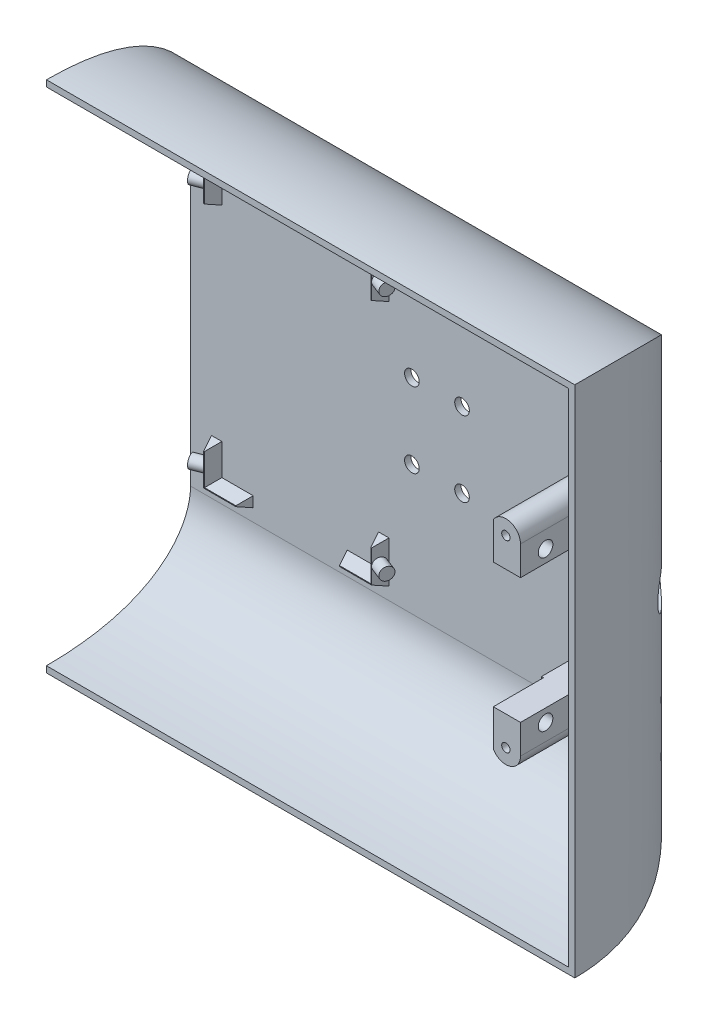
from build123d import *

# Parameters (mm, degrees)
BOSS_EXTRU_1_DEPTH           = 1.5
ENL_V_MAT_EXTRU_1_REACH      = 126.854
ESQUISSE3_R                  = 1.75
ESQUISSE4_W                  = 2.5
ESQUISSE4_H                  = 10
BOSS_EXTRU_2_DEPTH           = 3
BOSS_EXTRU_2_DRAFT           = -21
ESQUISSE4_W_2                = 10
ESQUISSE4_H_2                = 2.5
BOSS_EXTRU_2_PROFILE_2_DEPTH = 3
BOSS_EXTRU_2_PROFILE_2_DRAFT = -21
BOSS_EXTRU_2_PROFILE_3_DEPTH = 3
BOSS_EXTRU_2_PROFILE_3_DRAFT = -21
BOSS_EXTRU_2_PROFILE_4_DEPTH = 3
BOSS_EXTRU_2_PROFILE_4_DRAFT = -21
BOSS_EXTRU_2_PROFILE_5_DEPTH = 3
BOSS_EXTRU_2_PROFILE_5_DRAFT = -21
BOSS_EXTRU_2_PROFILE_6_DEPTH = 3
BOSS_EXTRU_2_PROFILE_6_DRAFT = -21
ENL_V_MAT_EXTRU_2_REACH      = 161.094
ESQUISSE8_R                  = 1
BOSS_EXTRU_3_REACH           = 161.094
ESQUISSE9_R                  = 1
ENL_V_MAT_EXTRU_3_DEPTH      = 12
ENL_V_MAT_EXTRU_4_REACH      = 149.782
ESQUISSE11_R                 = 1.75
BOSS_EXTRU_4_REACH           = 149.42
ESQUISSE16_W                 = 15
ESQUISSE16_H                 = 12
ENL_V_MAT_EXTRU_5_REACH      = 211.69
ESQUISSE12_R                 = 4.25
ESQUISSE17_W                 = 4
ESQUISSE17_H                 = 12
ENL_V_MAT_EXTRU_6_DEPTH      = 8
ESQUISSE20_R                 = 1.5
BOSS_EXTRU_5_DEPTH           = 3
ESQUISSE21_R                 = 1.5
BOSS_EXTRU_6_DEPTH           = 3


with BuildPart() as part:
    # Esquisse1 → Boss.-Extru.1 (new body)
    with BuildSketch(Plane.XY):
        Polygon((100.649081925, 73.864865318), (-4.350918075, 73.864865318), (-4.350918075, 33.864865318), (-4.350918075, -6.135134682), (100.649081925, -6.135134682), align=None)
    extrude(amount=BOSS_EXTRU_1_DEPTH)

    # Esquisse3 → Enlèv. mat.-Extru.1 (cut, up to next)
    with BuildSketch(Plane.XY.offset(1.5), mode=Mode.PRIVATE) as enl_v_mat_extru_1_sk1:
        with Locations((48.649081925, 42.864865318)):
            Circle(ESQUISSE3_R)
    enl_v_mat_extru_1_tool1 = extrude(enl_v_mat_extru_1_sk1.sketch, amount=-ENL_V_MAT_EXTRU_1_REACH, mode=Mode.PRIVATE) & part.part
    # Esquisse3 → Enlèv. mat.-Extru.1 (cut, up to next)
    with BuildSketch(Plane.XY.offset(1.5), mode=Mode.PRIVATE) as enl_v_mat_extru_1_sk2:
        with Locations((48.649081925, 24.864865318)):
            Circle(ESQUISSE3_R)
    enl_v_mat_extru_1_tool2 = extrude(enl_v_mat_extru_1_sk2.sketch, amount=-ENL_V_MAT_EXTRU_1_REACH, mode=Mode.PRIVATE) & part.part
    # Esquisse3 → Enlèv. mat.-Extru.1 (cut, up to next)
    with BuildSketch(Plane.XY.offset(1.5), mode=Mode.PRIVATE) as enl_v_mat_extru_1_sk3:
        with Locations((60.649081925, 24.864865318)):
            Circle(ESQUISSE3_R)
    enl_v_mat_extru_1_tool3 = extrude(enl_v_mat_extru_1_sk3.sketch, amount=-ENL_V_MAT_EXTRU_1_REACH, mode=Mode.PRIVATE) & part.part
    # Esquisse3 → Enlèv. mat.-Extru.1 (cut, up to next)
    with BuildSketch(Plane.XY.offset(1.5), mode=Mode.PRIVATE) as enl_v_mat_extru_1_sk4:
        with Locations((60.649081925, 42.864865318)):
            Circle(ESQUISSE3_R)
    enl_v_mat_extru_1_tool4 = extrude(enl_v_mat_extru_1_sk4.sketch, amount=-ENL_V_MAT_EXTRU_1_REACH, mode=Mode.PRIVATE) & part.part
    add(enl_v_mat_extru_1_tool1.solids().sort_by_distance((48.649082, 42.864865, 1.5))[0], mode=Mode.SUBTRACT)
    add(enl_v_mat_extru_1_tool2.solids().sort_by_distance((48.649082, 24.864865, 1.5))[0], mode=Mode.SUBTRACT)
    add(enl_v_mat_extru_1_tool3.solids().sort_by_distance((60.649082, 24.864865, 1.5))[0], mode=Mode.SUBTRACT)
    add(enl_v_mat_extru_1_tool4.solids().sort_by_distance((60.649082, 42.864865, 1.5))[0], mode=Mode.SUBTRACT)


with BuildPart() as boss_extru_2_tool:
    # Esquisse4 → Boss.-Extru.2 (with draft: the straight prism first)
    with BuildSketch(Plane(origin=(0, 0, 1.5), x_dir=(-1, 0, 0), z_dir=(0, 0, -1))):
        with Locations((-1.899081925, 60.864865318)):
            Rectangle(ESQUISSE4_W, ESQUISSE4_H)
    extrude(amount=-BOSS_EXTRU_2_DEPTH)
    # Boss.-Extru.2: the draft: its side faces are tilted about the plane it starts from
    boss_extru_2_sides = [boss_extru_2_tool.faces().sort_by_distance(p)[0] for p in [
        (3.149081925, 60.864865318, 3),
        (1.899081925, 55.864865318, 3),
        (0.649081925, 60.864865318, 3),
        (1.899081925, 65.864865318, 3),
    ]]
    draft(boss_extru_2_sides, Plane(origin=(0, 0, 1.5), x_dir=(-1, 0, 0), z_dir=(0, 0, -1)), BOSS_EXTRU_2_DRAFT)


with BuildPart() as part_1:
    add(part.part)

    # Boss.-Extru.2: add boss_extru_2_tool
    add(boss_extru_2_tool.part)


with BuildPart() as boss_extru_2_profile_2_tool:
    # Esquisse4 → Boss.-Extru.2 profile 2 (with draft: the straight prism first)
    with BuildSketch(Plane(origin=(0, 0, 1.5), x_dir=(-1, 0, 0), z_dir=(0, 0, -1))):
        with Locations((-10.649081925, 69.614865318)):
            Rectangle(ESQUISSE4_W_2, ESQUISSE4_H_2)
    extrude(amount=-BOSS_EXTRU_2_PROFILE_2_DEPTH)
    # Boss.-Extru.2 profile 2: the draft: its side faces are tilted about the plane it starts from
    boss_extru_2_profile_2_sides = [boss_extru_2_profile_2_tool.faces().sort_by_distance(p)[0] for p in [
        (10.649081925, 70.864865318, 3),
        (15.649081925, 69.614865318, 3),
        (10.649081925, 68.364865318, 3),
        (5.649081925, 69.614865318, 3),
    ]]
    draft(boss_extru_2_profile_2_sides, Plane(origin=(0, 0, 1.5), x_dir=(-1, 0, 0), z_dir=(0, 0, -1)), BOSS_EXTRU_2_PROFILE_2_DRAFT)


with BuildPart() as part_2:
    add(part_1.part)

    # Boss.-Extru.2 profile 2: add boss_extru_2_profile_2_tool
    add(boss_extru_2_profile_2_tool.part)


with BuildPart() as boss_extru_2_profile_3_tool:
    # Esquisse4 → Boss.-Extru.2 profile 3 (with draft: the straight prism first)
    with BuildSketch(Plane(origin=(0, 0, 1.5), x_dir=(-1, 0, 0), z_dir=(0, 0, -1))):
        with Locations((-41.899081925, 60.864865318)):
            Rectangle(ESQUISSE4_W, ESQUISSE4_H)
    extrude(amount=-BOSS_EXTRU_2_PROFILE_3_DEPTH)
    # Boss.-Extru.2 profile 3: the draft: its side faces are tilted about the plane it starts from
    boss_extru_2_profile_3_sides = [boss_extru_2_profile_3_tool.faces().sort_by_distance(p)[0] for p in [
        (41.899081925, 65.864865318, 3),
        (43.149081925, 60.864865318, 3),
        (41.899081925, 55.864865318, 3),
        (40.649081925, 60.864865318, 3),
    ]]
    draft(boss_extru_2_profile_3_sides, Plane(origin=(0, 0, 1.5), x_dir=(-1, 0, 0), z_dir=(0, 0, -1)), BOSS_EXTRU_2_PROFILE_3_DRAFT)


with BuildPart() as part_3:
    add(part_2.part)

    # Boss.-Extru.2 profile 3: add boss_extru_2_profile_3_tool
    add(boss_extru_2_profile_3_tool.part)


with BuildPart() as boss_extru_2_profile_4_tool:
    # Esquisse4 → Boss.-Extru.2 profile 4 (with draft: the straight prism first)
    with BuildSketch(Plane(origin=(0, 0, 1.5), x_dir=(-1, 0, 0), z_dir=(0, 0, -1))):
        with Locations((-33.149081925, 69.614865318)):
            Rectangle(ESQUISSE4_W_2, ESQUISSE4_H_2)
    extrude(amount=-BOSS_EXTRU_2_PROFILE_4_DEPTH)
    # Boss.-Extru.2 profile 4: the draft: its side faces are tilted about the plane it starts from
    boss_extru_2_profile_4_sides = [boss_extru_2_profile_4_tool.faces().sort_by_distance(p)[0] for p in [
        (38.149081925, 69.614865318, 3),
        (33.149081925, 68.364865318, 3),
        (28.149081925, 69.614865318, 3),
        (33.149081925, 70.864865318, 3),
    ]]
    draft(boss_extru_2_profile_4_sides, Plane(origin=(0, 0, 1.5), x_dir=(-1, 0, 0), z_dir=(0, 0, -1)), BOSS_EXTRU_2_PROFILE_4_DRAFT)


with BuildPart() as part_4:
    add(part_3.part)

    # Boss.-Extru.2 profile 4: add boss_extru_2_profile_4_tool
    add(boss_extru_2_profile_4_tool.part)


with BuildPart() as boss_extru_2_profile_5_tool:
    # Esquisse4 → Boss.-Extru.2 profile 5 (with draft: the straight prism first)
    with BuildSketch(Plane(origin=(0, 0, 1.5), x_dir=(-1, 0, 0), z_dir=(0, 0, -1))):
        Polygon((-40.649081925, 6.864865318), (-43.149081925, 6.864865318), (-43.149081925, -3.135134682), (-33.149081925, -3.135134682), (-33.149081925, -0.635134682), (-40.649081925, -0.635134682), align=None)
    extrude(amount=-BOSS_EXTRU_2_PROFILE_5_DEPTH)
    # Boss.-Extru.2 profile 5: the draft: its side faces are tilted about the plane it starts from
    boss_extru_2_profile_5_sides = [boss_extru_2_profile_5_tool.faces().sort_by_distance(p)[0] for p in [
        (41.899081925, 6.864865318, 3),
        (43.149081925, 1.864865318, 3),
        (38.149081925, -3.135134682, 3),
        (33.149081925, -1.885134682, 3),
        (36.899081925, -0.635134682, 3),
        (40.649081925, 3.114865318, 3),
    ]]
    draft(boss_extru_2_profile_5_sides, Plane(origin=(0, 0, 1.5), x_dir=(-1, 0, 0), z_dir=(0, 0, -1)), BOSS_EXTRU_2_PROFILE_5_DRAFT)


with BuildPart() as part_5:
    add(part_4.part)

    # Boss.-Extru.2 profile 5: add boss_extru_2_profile_5_tool
    add(boss_extru_2_profile_5_tool.part)


with BuildPart() as boss_extru_2_profile_6_tool:
    # Esquisse4 → Boss.-Extru.2 profile 6 (with draft: the straight prism first)
    with BuildSketch(Plane(origin=(0, 0, 1.5), x_dir=(-1, 0, 0), z_dir=(0, 0, -1))):
        Polygon((-10.649081925, -0.635134682), (-10.649081925, -3.135134682), (-0.649081925, -3.135134682), (-0.649081925, 6.864865318), (-3.149081925, 6.864865318), (-3.149081925, -0.635134682), align=None)
    extrude(amount=-BOSS_EXTRU_2_PROFILE_6_DEPTH)
    # Boss.-Extru.2 profile 6: the draft: its side faces are tilted about the plane it starts from
    boss_extru_2_profile_6_sides = [boss_extru_2_profile_6_tool.faces().sort_by_distance(p)[0] for p in [
        (10.649081925, -1.885134682, 3),
        (5.649081925, -3.135134682, 3),
        (0.649081925, 1.864865318, 3),
        (1.899081925, 6.864865318, 3),
        (3.149081925, 3.114865318, 3),
        (6.899081925, -0.635134682, 3),
    ]]
    draft(boss_extru_2_profile_6_sides, Plane(origin=(0, 0, 1.5), x_dir=(-1, 0, 0), z_dir=(0, 0, -1)), BOSS_EXTRU_2_PROFILE_6_DRAFT)


with BuildPart() as part_6:
    add(part_5.part)

    # Boss.-Extru.2 profile 6: add boss_extru_2_profile_6_tool
    add(boss_extru_2_profile_6_tool.part)

    # Balayage1: sweep along a path in Esquisse19
    with BuildLine(Plane(origin=(0, 0, 0), x_dir=(-1, 0, 0), z_dir=(0, 0, -1))) as balayage1_path:
        Line((4.350918075, -6.135134682), (-100.649081925, -6.135134682))
        Line((-100.649081925, -6.135134682), (-100.649081925, 73.864865318))
        Line((-100.649081925, 73.864865318), (4.350918075, 73.864865318))
    # Esquisse7 → Balayage1 (sweep)
    with BuildSketch(Plane.ZY.offset(4.350918075)):
        with BuildLine():
            Line((1.5, 73.864865318), (0, 73.864865318))
            add(Edge.make_bspline(
                [(0, 73.864865318), (0, 82.293472047), (9.196933608, 95.364865318), (36, 95.364865318)],
                knots=[0, 0, 0, 0, 1, 1, 1, 1], degree=3))
            Line((36, 95.364865318), (36, 93.864865318))
            add(Edge.make_bspline(
                [(1.5, 73.864865318), (1.5, 82.116049493), (9.427617929, 93.864865318), (36, 93.864865318)],
                knots=[0, 0, 0, 0, 1, 1, 1, 1], degree=3))
        make_face()
    sweep(path=balayage1_path.line, transition=Transition.RIGHT)

    # Esquisse8 → Enlèv. mat.-Extru.2 (cut, up to next)
    with BuildSketch(Plane(origin=(0, 0, 0), x_dir=(-1, 0, 0), z_dir=(0, 0, -1)), mode=Mode.PRIVATE) as enl_v_mat_extru_2_sk1:
        with Locations((-105.649081925, 55.864865318)):
            Circle(ESQUISSE8_R)
    enl_v_mat_extru_2_tool1 = extrude(enl_v_mat_extru_2_sk1.sketch, amount=-ENL_V_MAT_EXTRU_2_REACH, mode=Mode.PRIVATE) & part_6.part
    # Esquisse8 → Enlèv. mat.-Extru.2 (cut, up to next)
    with BuildSketch(Plane(origin=(0, 0, 0), x_dir=(-1, 0, 0), z_dir=(0, 0, -1)), mode=Mode.PRIVATE) as enl_v_mat_extru_2_sk2:
        with Locations((-105.649081925, 11.864865318)):
            Circle(ESQUISSE8_R)
    enl_v_mat_extru_2_tool2 = extrude(enl_v_mat_extru_2_sk2.sketch, amount=-ENL_V_MAT_EXTRU_2_REACH, mode=Mode.PRIVATE) & part_6.part
    add(enl_v_mat_extru_2_tool1.solids().sort_by_distance((105.649082, 55.864865, 0))[0], mode=Mode.SUBTRACT)
    add(enl_v_mat_extru_2_tool2.solids().sort_by_distance((105.649082, 11.864865, 0))[0], mode=Mode.SUBTRACT)

    # Esquisse9 → Boss.-Extru.3 (add, up to next)
    with BuildSketch(Plane.XY.offset(36), mode=Mode.PRIVATE) as boss_extru_3_sk1:
        with BuildLine():
            Line((102.149081925, 55.864865318), (102.149081925, 48.864865318))
            Line((102.149081925, 48.864865318), (109.149081925, 48.864865318))
            Line((109.149081925, 48.864865318), (109.149081925, 55.864865318))
            ThreePointArc((109.149081925, 55.864865318), (105.649081925, 59.364865318), (102.149081925, 55.864865318))
        make_face()
        with Locations(Location((105.649081925, 55.864865318, 0), (0, 0, 180))):
            Circle(ESQUISSE9_R, mode=Mode.SUBTRACT)
    boss_extru_3_tool1 = extrude(boss_extru_3_sk1.sketch, amount=-BOSS_EXTRU_3_REACH, mode=Mode.PRIVATE) - part_6.part
    # Esquisse9 → Boss.-Extru.3 (add, up to next)
    with BuildSketch(Plane.XY.offset(36), mode=Mode.PRIVATE) as boss_extru_3_sk2:
        with BuildLine():
            Line((109.149081925, 11.864865318), (109.149081925, 18.864865318))
            Line((109.149081925, 18.864865318), (102.149081925, 18.864865318))
            Line((102.149081925, 18.864865318), (102.149081925, 11.864865318))
            ThreePointArc((102.149081925, 11.864865318), (105.649081925, 8.364865318), (109.149081925, 11.864865318))
        make_face()
        with Locations(Location((105.649081925, 11.864865318, 0), (0, 0, 180))):
            Circle(ESQUISSE9_R, mode=Mode.SUBTRACT)
    boss_extru_3_tool2 = extrude(boss_extru_3_sk2.sketch, amount=-BOSS_EXTRU_3_REACH, mode=Mode.PRIVATE) - part_6.part
    add(boss_extru_3_tool1.solids().sort_by_distance((105.649082, 53.669547, 36))[0])
    add(boss_extru_3_tool2.solids().sort_by_distance((105.649082, 14.060183, 36))[0])

    # Esquisse10 → Enlèv. mat.-Extru.3 (cut)
    with BuildSketch(Plane.XY.offset(36)):
        with BuildLine():
            Line((102.649081925, 10.06208968), (102.649081925, 18.864865318))
            Line((102.649081925, 18.864865318), (102.149081925, 18.864865318))
            Line((102.149081925, 18.864865318), (102.149081925, 11.864865318))
            ThreePointArc((102.149081925, 11.864865318), (102.276397535, 10.929450971), (102.649081925, 10.06208968))
        make_face()
        with BuildLine():
            Line((102.649081925, 48.864865318), (102.649081925, 57.667640956))
            ThreePointArc((102.649081925, 57.667640956), (102.276397535, 56.800279665), (102.149081925, 55.864865318))
            Line((102.149081925, 55.864865318), (102.149081925, 48.864865318))
            Line((102.149081925, 48.864865318), (102.649081925, 48.864865318))
        make_face()
    extrude(amount=-ENL_V_MAT_EXTRU_3_DEPTH, mode=Mode.SUBTRACT)

    # Esquisse11 → Enlèv. mat.-Extru.4 (cut, up to next)
    with BuildSketch(Plane.ZY.offset(-102.649081925), mode=Mode.PRIVATE) as enl_v_mat_extru_4_sk1:
        with Locations((30, 51.864865318)):
            Circle(ESQUISSE11_R)
    enl_v_mat_extru_4_tool1 = extrude(enl_v_mat_extru_4_sk1.sketch, amount=-ENL_V_MAT_EXTRU_4_REACH, mode=Mode.PRIVATE) & part_6.part
    # Esquisse11 → Enlèv. mat.-Extru.4 (cut, up to next)
    with BuildSketch(Plane.ZY.offset(-102.649081925), mode=Mode.PRIVATE) as enl_v_mat_extru_4_sk2:
        with Locations((30, 15.864865318)):
            Circle(ESQUISSE11_R)
    enl_v_mat_extru_4_tool2 = extrude(enl_v_mat_extru_4_sk2.sketch, amount=-ENL_V_MAT_EXTRU_4_REACH, mode=Mode.PRIVATE) & part_6.part
    add(enl_v_mat_extru_4_tool1.solids().sort_by_distance((102.649082, 51.864865, 30))[0], mode=Mode.SUBTRACT)
    add(enl_v_mat_extru_4_tool2.solids().sort_by_distance((102.649082, 15.864865, 30))[0], mode=Mode.SUBTRACT)

    # Esquisse16 → Boss.-Extru.4 (add, up to next)
    with BuildSketch(Plane.ZY.offset(-102.149081925), mode=Mode.PRIVATE) as boss_extru_4_sk1:
        with Locations((9.0856849, 33.864865318)):
            Rectangle(ESQUISSE16_W, ESQUISSE16_H)
    boss_extru_4_tool1 = extrude(boss_extru_4_sk1.sketch, amount=-BOSS_EXTRU_4_REACH, mode=Mode.PRIVATE) - part_6.part
    add(boss_extru_4_tool1.solids().sort_by_distance((102.149082, 33.864865, 9.085685))[0])

    # Enlèv. mat.-Extru.5: up to this plane
    enl_v_mat_extru_5_end = Plane(origin=(102.149081925, 0, 0), z_dir=(-1, 0, 0))
    # Esquisse12 → Enlèv. mat.-Extru.5 (cut, up to the surface)
    with BuildSketch(Plane(origin=(157.424011878, 0, -57.297654482), x_dir=(-0.34202014332566427, 0, -0.93969262078591), z_dir=(0.93969262078591, -1.2457869471927707e-15, -0.34202014332566427)), mode=Mode.PRIVATE) as enl_v_mat_extru_5_sk1:
        with Locations((-44.71825261, 33.864865318)):
            Circle(ESQUISSE12_R)
    enl_v_mat_extru_5_tool1 = split(extrude(enl_v_mat_extru_5_sk1.sketch, amount=-ENL_V_MAT_EXTRU_5_REACH, mode=Mode.PRIVATE), bisect_by=enl_v_mat_extru_5_end, keep=Keep.BOTH, mode=Mode.PRIVATE)
    add(enl_v_mat_extru_5_tool1.solids().sort_by_distance((172.718555, 33.864865, -15.276242))[0], mode=Mode.SUBTRACT)

    # Esquisse17 → Enlèv. mat.-Extru.6 (cut)
    with BuildSketch(Plane.XY.offset(16.5856849)):
        with Locations((109.149081925, 33.864865318)):
            Rectangle(ESQUISSE17_W, ESQUISSE17_H)
    extrude(amount=-ENL_V_MAT_EXTRU_6_DEPTH, mode=Mode.SUBTRACT)

    # Esquisse20 → Boss.-Extru.5 (add)
    with BuildSketch(Plane(origin=(0.063873945, 0, -0.02451891), x_dir=(0.3583679495453005, 0, 0.9335804264972016), z_dir=(-0.9335804264972016, 0, 0.3583679495453005))):
        with Locations((3.346415779, 60.864865318)):
            Circle(ESQUISSE20_R)
        with Locations((3.346415779, 1.864865318)):
            Circle(ESQUISSE20_R)
    extrude(amount=BOSS_EXTRU_5_DEPTH)

    # Esquisse21 → Boss.-Extru.6 (add)
    with BuildSketch(Plane(origin=(38.109397396, 0, 14.628827057), x_dir=(0.3583679495453005, 0, -0.9335804264972016), z_dir=(0.9335804264972016, 0, 0.3583679495453005))):
        with Locations(Location((12.349442394, 60.864865318, 0), (0, 0, 180))):
            Circle(ESQUISSE21_R)
        with Locations(Location((12.349442394, 1.864865318, 0), (0, 0, 180))):
            Circle(ESQUISSE21_R)
    extrude(amount=BOSS_EXTRU_6_DEPTH)


solid = part_6.part
